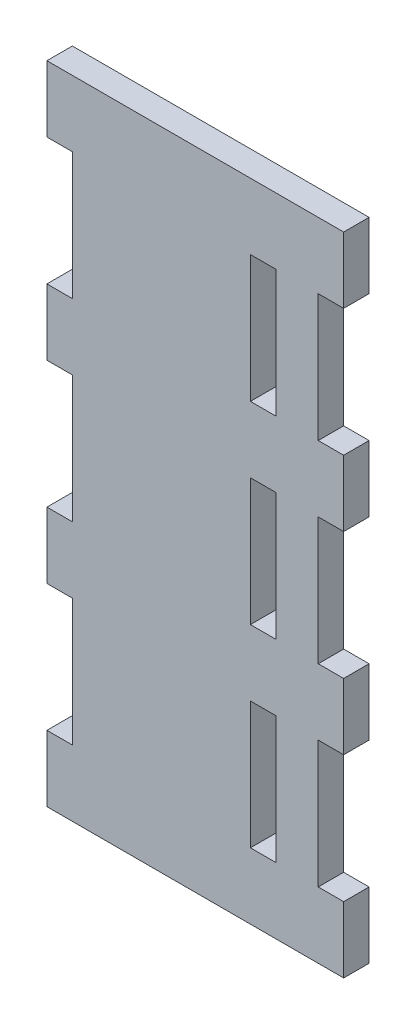
from build123d import *

# Parameters (mm, degrees)
SKETCH1_W           = 35
SKETCH1_H           = 76.2
BOSS_EXTRUDE1_DEPTH = 3
SKETCH2_W           = 3
SKETCH2_H           = 15
CUT_EXTRUDE1_DEPTH  = 73.446802019
LPATTERN1_COUNT     = 3
LPATTERN1_PITCH     = 22.8
SKETCH3_W           = 3
SKETCH3_H           = 15
CUT_EXTRUDE2_DEPTH  = 73.446802019
LPATTERN2_COUNT     = 3
LPATTERN2_PITCH     = 22.8


with BuildPart() as part:
    # Sketch1 → Boss-Extrude1 (new body)
    with BuildSketch(Plane.XY):
        with Locations((-23.493460648, -21.557986111)):
            Rectangle(SKETCH1_W, SKETCH1_H)
    extrude(amount=BOSS_EXTRUDE1_DEPTH)

    # Sketch2 → Cut-Extrude1 (cut, through all)
    with BuildSketch(Plane.XY.offset(3)):
        with Locations((-39.493460648, 1.242013889)):
            Rectangle(SKETCH2_W, SKETCH2_H)
        with Locations((-7.493460648, 1.242013889)):
            Rectangle(SKETCH2_W, SKETCH2_H)
    cut_extrude1 = extrude(amount=-CUT_EXTRUDE1_DEPTH, mode=Mode.SUBTRACT)

    # LPattern1: Cut-Extrude1 ×3
    with Locations(*[(0, -i * LPATTERN1_PITCH, 0) for i in range(1, LPATTERN1_COUNT)]):
        add(cut_extrude1, mode=Mode.SUBTRACT)

    # Sketch3 → Cut-Extrude2 (cut, through all)
    with BuildSketch(Plane.XY.offset(3)):
        with Locations((-15.493460648, 1.242013889)):
            Rectangle(SKETCH3_W, SKETCH3_H)
    cut_extrude2 = extrude(amount=-CUT_EXTRUDE2_DEPTH, mode=Mode.SUBTRACT)

    # LPattern2: Cut-Extrude2 ×3
    with Locations(*[(0, -i * LPATTERN2_PITCH, 0) for i in range(1, LPATTERN2_COUNT)]):
        add(cut_extrude2, mode=Mode.SUBTRACT)


solid = part.part
